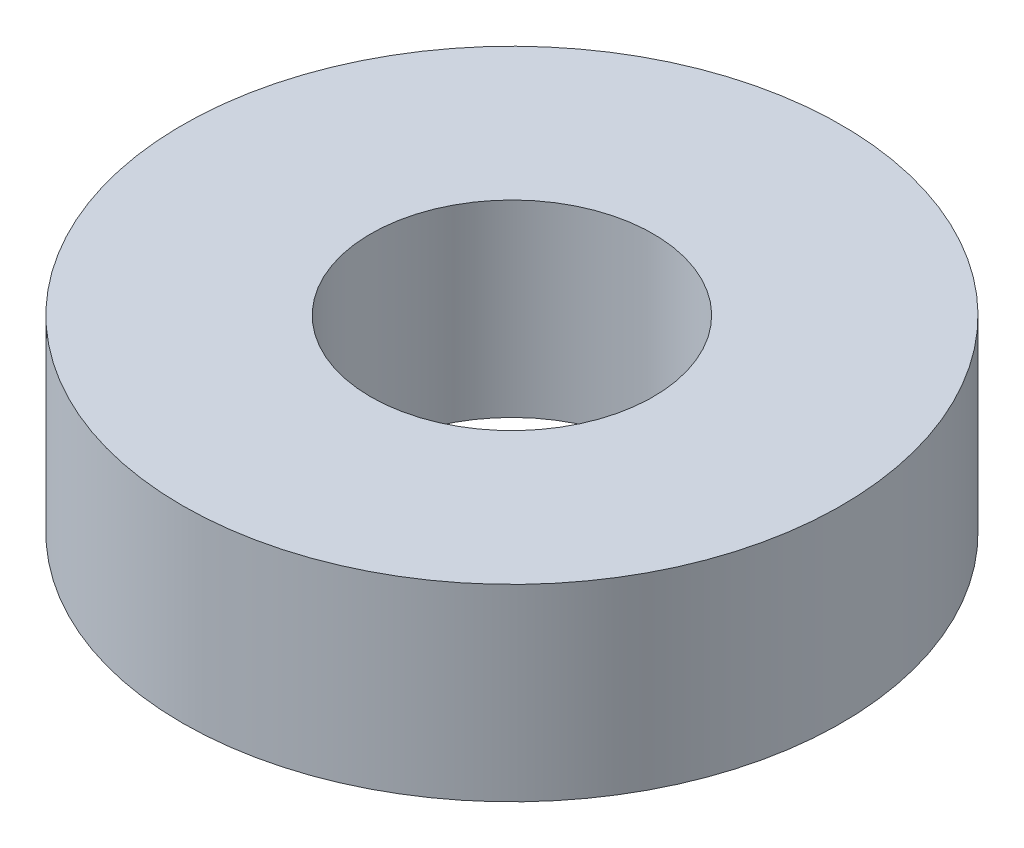
from build123d import *

# Parameters (mm, degrees)
SKETCH_1_R      = 3.5
SKETCH_1_R_2    = 1.5
EXTRUDE_1_DEPTH = 2


with BuildPart() as part:
    # 草图1 → 凸台-拉伸1 (new body)
    with BuildSketch(Plane(origin=(0, 0, 0), x_dir=(1, 0, 0), z_dir=(0, 1, 0))):
        with Locations(Location((0, 0, 0), (0, 0, 270))):
            Circle(SKETCH_1_R)
        with Locations(Location((0, 0, 0), (0, 0, 270))):
            Circle(SKETCH_1_R_2, mode=Mode.SUBTRACT)
    extrude(amount=EXTRUDE_1_DEPTH)


solid = part.part
